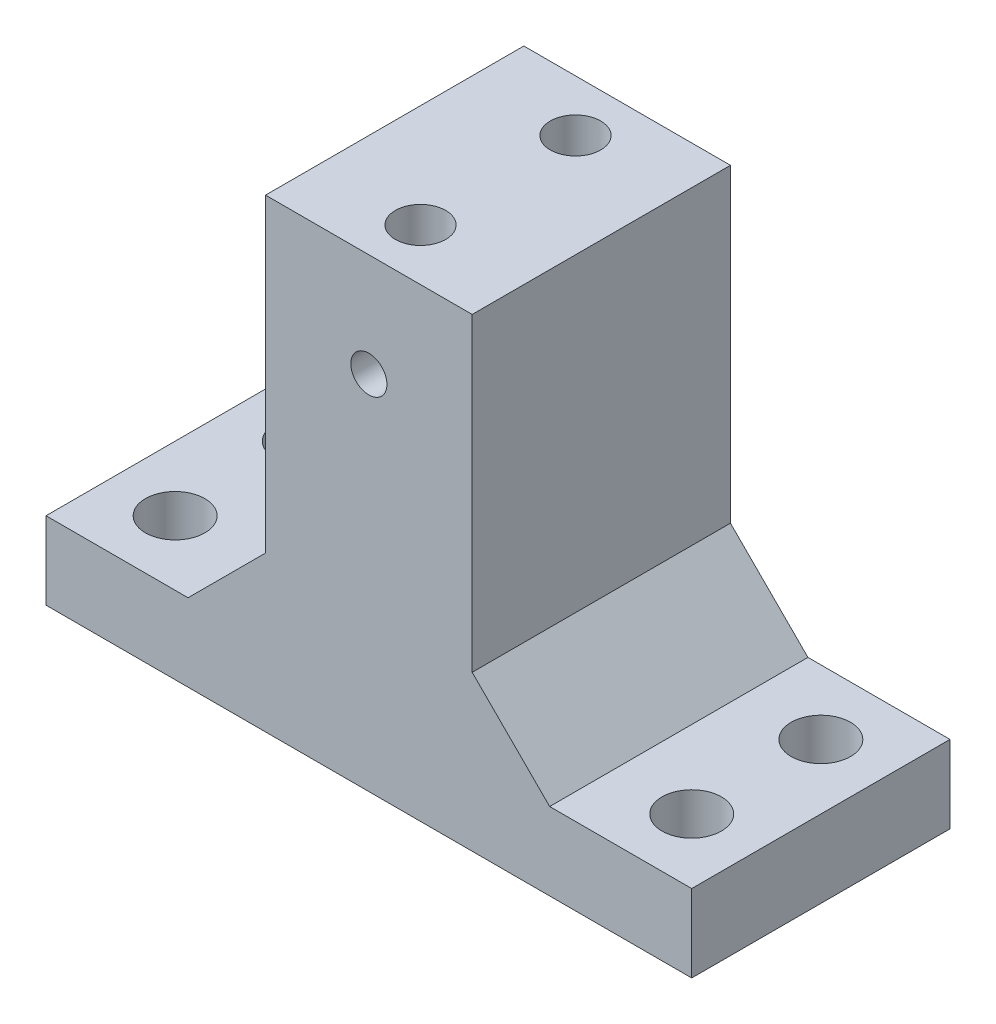
from build123d import *

# Parameters (mm, degrees)
SKETCH1_W           = 25
SKETCH1_H           = 10
SKETCH1_R           = 1.15
BOSS_EXTRUDE1_DEPTH = 3
SKETCH3_W           = 8
SKETCH3_H           = 18
SKETCH3_R           = 0.7
BOSS_EXTRUDE2_DEPTH = 10
SKETCH5_R           = 0.975
CUT_EXTRUDE2_DEPTH  = 3.5
CHAMFER1_SIZE       = 3


with BuildPart() as part:
    # Sketch1 → Boss-Extrude1 (new body)
    with BuildSketch(Plane(origin=(0, 0, 0), x_dir=(1, 0, 0), z_dir=(0, 1, 0))):
        Rectangle(SKETCH1_W, SKETCH1_H)
        with Locations(Location((-10, 2.5, 0), (0, 0, 270))):
            Circle(SKETCH1_R, mode=Mode.SUBTRACT)
        with Locations(Location((-10, -2.5, 0), (0, 0, 270))):
            Circle(SKETCH1_R, mode=Mode.SUBTRACT)
        with Locations(Location((10, 2.5, 0), (0, 0, 270))):
            Circle(SKETCH1_R, mode=Mode.SUBTRACT)
        with Locations(Location((10, -2.5, 0), (0, 0, 270))):
            Circle(SKETCH1_R, mode=Mode.SUBTRACT)
    extrude(amount=BOSS_EXTRUDE1_DEPTH)

    # Sketch3 → Boss-Extrude2 (add)
    with BuildSketch(Plane(origin=(0, 0, -5), x_dir=(-1, 0, 0), z_dir=(0, 0, -1))):
        with Locations((0, 9)):
            Rectangle(SKETCH3_W, SKETCH3_H)
        with Locations((0, 14)):
            Circle(SKETCH3_R, mode=Mode.SUBTRACT)
    extrude(amount=-BOSS_EXTRUDE2_DEPTH)

    # Sketch5 → Cut-Extrude2 (cut)
    with BuildSketch(Plane(origin=(0, 18, 0), x_dir=(1, 0, 0), z_dir=(0, 1, 0))):
        with Locations(Location((0, 3, 0), (0, 0, 180))):
            Circle(SKETCH5_R)
        with Locations(Location((0, -3, 0), (0, 0, 180))):
            Circle(SKETCH5_R)
    extrude(amount=-CUT_EXTRUDE2_DEPTH, mode=Mode.SUBTRACT)

    # Chamfer1
    chamfer1_edges = [part.edges().sort_by_distance(p)[0] for p in [
        (-4, 3, 0),
        (4, 3, 0),
    ]]
    chamfer(chamfer1_edges, length=CHAMFER1_SIZE)


solid = part.part
